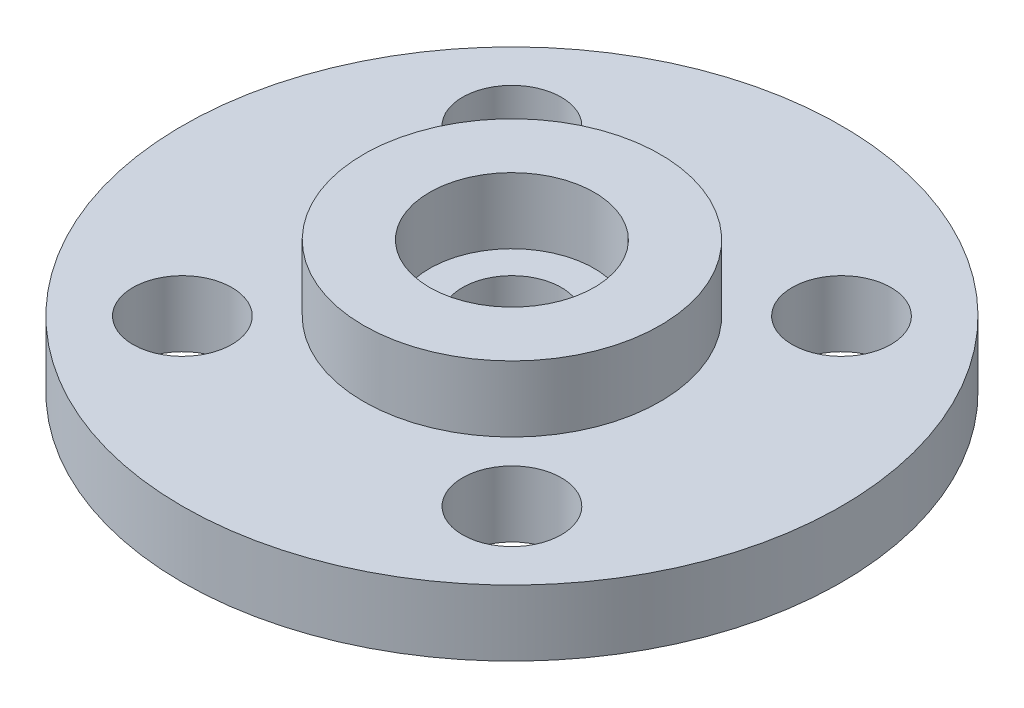
from build123d import *

# Parameters (mm, degrees)
SKETCH1_R           = 10
SKETCH1_R_2         = 1.5
BOSS_EXTRUDE1_DEPTH = 2
SKETCH2_R           = 4.5
SKETCH2_R_2         = 2.5
BOSS_EXTRUDE2_DEPTH = 2


with BuildPart() as part:
    # Sketch1 → Boss-Extrude1 (new body)
    with BuildSketch(Plane(origin=(0, 0, 0), x_dir=(1, 0, 0), z_dir=(0, 1, 0))):
        with Locations(Location((0, 0, 0), (0, 0, 270))):
            Circle(SKETCH1_R)
        with Locations(Location((0, 0, 0), (0, 0, 270))):
            Circle(SKETCH1_R_2, mode=Mode.SUBTRACT)
        with Locations(Location((-5, 5, 0), (0, 0, 270))):
            Circle(SKETCH1_R_2, mode=Mode.SUBTRACT)
        with Locations(Location((5, 5, 0), (0, 0, 270))):
            Circle(SKETCH1_R_2, mode=Mode.SUBTRACT)
        with Locations(Location((5, -5, 0), (0, 0, 270))):
            Circle(SKETCH1_R_2, mode=Mode.SUBTRACT)
        with Locations(Location((-5, -5, 0), (0, 0, 270))):
            Circle(SKETCH1_R_2, mode=Mode.SUBTRACT)
    extrude(amount=BOSS_EXTRUDE1_DEPTH)

    # Sketch2 → Boss-Extrude2 (add)
    with BuildSketch(Plane(origin=(0, 2, 0), x_dir=(1, 0, 0), z_dir=(0, 1, 0))):
        with Locations(Location((0, 0, 0), (0, 0, 270))):
            Circle(SKETCH2_R)
        with Locations(Location((0, 0, 0), (0, 0, 270))):
            Circle(SKETCH2_R_2, mode=Mode.SUBTRACT)
    extrude(amount=BOSS_EXTRUDE2_DEPTH)


solid = part.part
